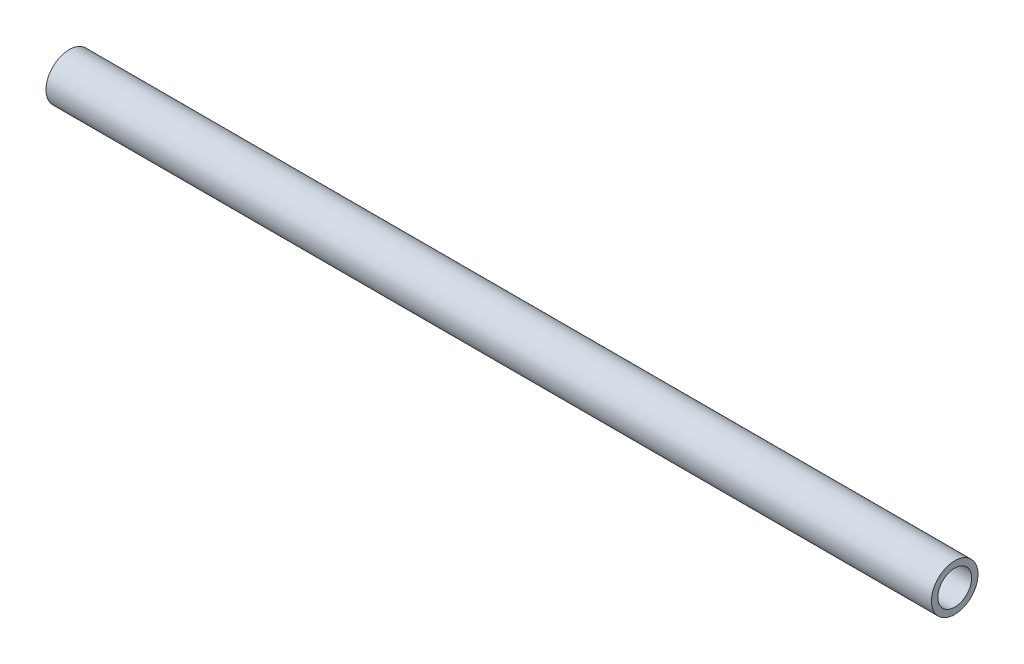
from build123d import *

# Parameters (mm, degrees)
SKETCH1_R           = 13.15
SKETCH1_R_2         = 9.55
BOSS_EXTRUDE1_DEPTH = 500


with BuildPart() as part:
    # Sketch1 → Boss-Extrude1 (new body)
    with BuildSketch(Plane(origin=(0, 0, 0), x_dir=(0, 0, -1), z_dir=(1, 0, 0))):
        Circle(SKETCH1_R)
        Circle(SKETCH1_R_2, mode=Mode.SUBTRACT)
    extrude(amount=BOSS_EXTRUDE1_DEPTH)


solid = part.part
